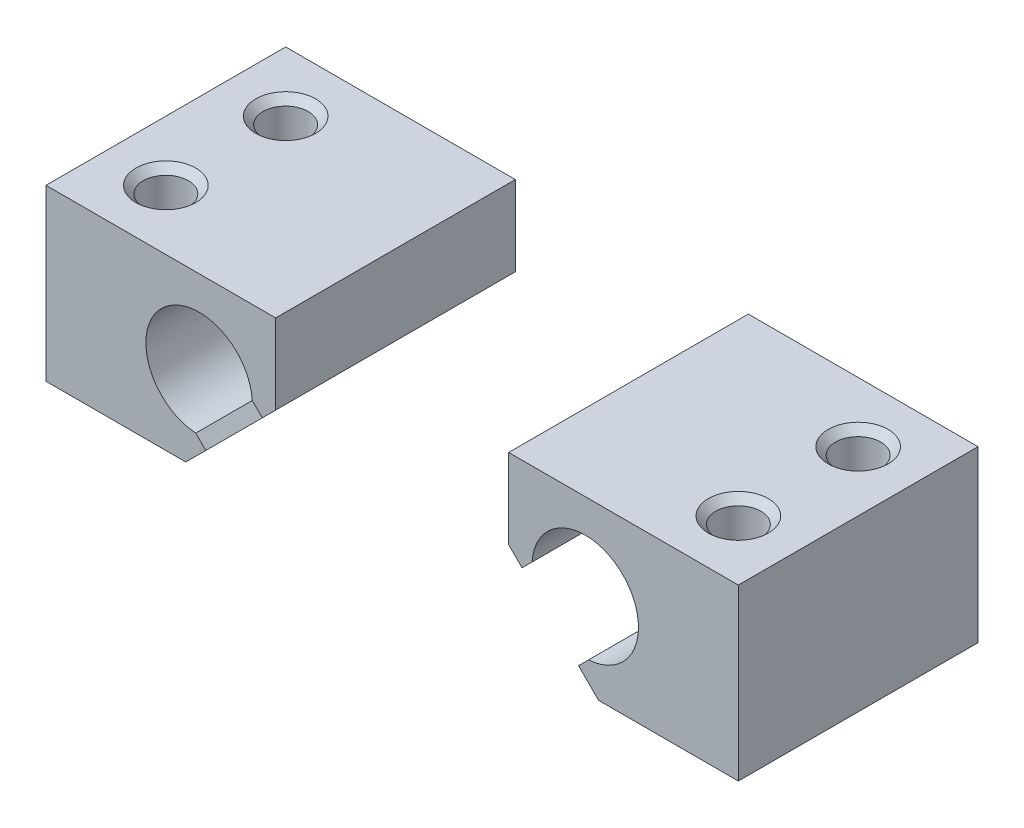
from build123d import *

# Parameters (mm, degrees)
BOSS_EXTRUDE1_DEPTH              = 18
M8X1_25_TAPPED_HOLE1_D           = 6.8
M8X1_25_TAPPED_HOLE1_CSINK_D     = 9
M8X1_25_TAPPED_HOLE1_CSINK_ANGLE = 90


with BuildPart() as part:
    # Sketch1 → Boss-Extrude1 (new, symmetric)
    with BuildSketch(Plane.XY):
        with BuildLine():
            Line((19.507359313, -14.007359313), (17.5, -12))
            Line((17.5, -12), (17.5, 0))
            Line((17.5, 0), (52, 0))
            Line((52, 0), (52, -25.5))
            Line((52, -25.5), (31, -25.5))
            Line((31, -25.5), (27.992640687, -22.492640687))
            Line((27.992640687, -22.492640687), (29.5009833, -20.984298074))
            ThreePointArc((29.5009833, -20.984298074), (34.656854249, -7.343145751), (21.015701926, -12.4990167))
            Line((21.015701926, -12.4990167), (19.507359313, -14.007359313))
        make_face()
    extrude(amount=BOSS_EXTRUDE1_DEPTH, both=True)

    # M8x1.25 Tapped Hole1 (through all)
    with Locations(Plane(origin=(0, 0, 0), x_dir=(-1, 0, 0), z_dir=(0, 1, 0))):
        with Locations((-43, -9), (-43, 9)):
            CounterSinkHole(M8X1_25_TAPPED_HOLE1_D / 2, M8X1_25_TAPPED_HOLE1_CSINK_D / 2, counter_sink_angle=M8X1_25_TAPPED_HOLE1_CSINK_ANGLE)


with BuildPart() as body_2:
    # Mirror2: mirrored copy
    add(part.part.mirror(Plane(origin=(0, 0, 0), x_dir=(0, 0, 1), z_dir=(1, 0, 0))))


solid = Compound([part.part, body_2.part])
